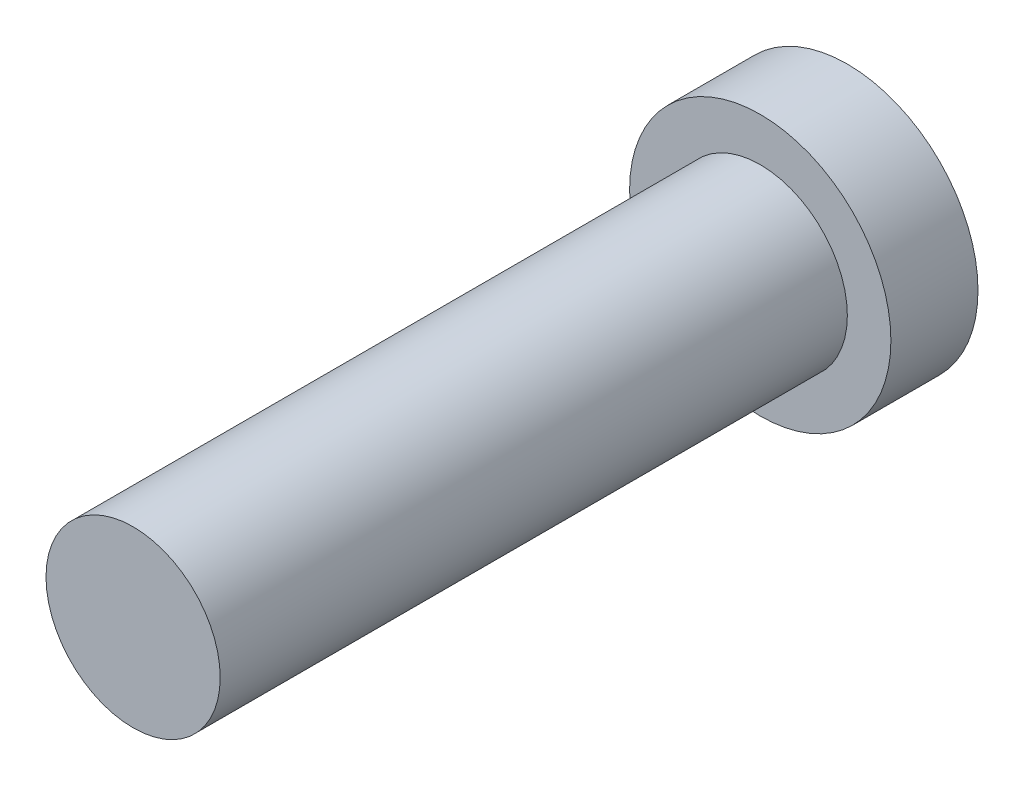
from build123d import *

# Parameters (mm, degrees)
SKETCH1_R           = 5
BOSS_EXTRUDE1_DEPTH = 36
SKETCH2_R           = 7.5
BOSS_EXTRUDE2_DEPTH = 5


with BuildPart() as part:
    # Sketch1 → Boss-Extrude1 (new body)
    with BuildSketch(Plane.XY):
        Circle(SKETCH1_R)
    extrude(amount=BOSS_EXTRUDE1_DEPTH)

    # Sketch2 → Boss-Extrude2 (add)
    with BuildSketch(Plane(origin=(0, 0, 0), x_dir=(-1, 0, 0), z_dir=(0, 0, -1))):
        Circle(SKETCH2_R)
    extrude(amount=BOSS_EXTRUDE2_DEPTH)


solid = part.part
